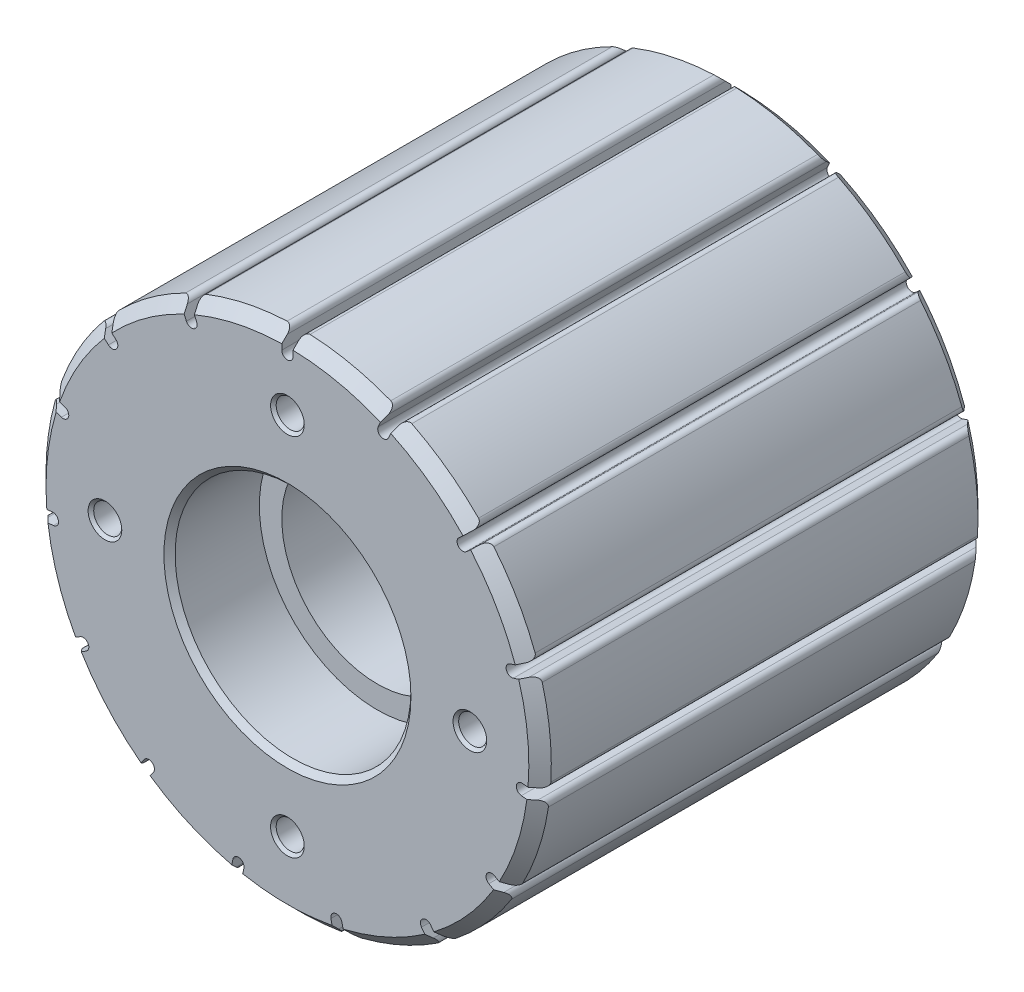
from build123d import *

# Parameters (mm, degrees)
SKETCH2_R                    = 45
SKETCH2_R_2                  = 21
BOSS_EXTRUDE1_DEPTH          = 40
CHAMFER3_SIZE                = 2
CUT_EXTRUDE1_DEPTH           = 76.166481892
FILLET1_R                    = 1
CIRPATTERN1_COUNT            = 15
FILLET1_OF_CIRPATTERN1_R     = 1
SKETCH4_R                    = 21
SKETCH4_R_2                  = 17
BOSS_EXTRUDE2_DEPTH          = 24
SKETCH6_W                    = 1.85
SKETCH6_H                    = 23.75
CHAMFER2_SIZE                = 1
SKETCH8_R                    = 2.5
CUT_EXTRUDE2_DEPTH           = 25
CHAMFER1_SIZE                = 0.5
CIRPATTERN2_COUNT            = 4
CHAMFER1_OF_CIRPATTERN2_SIZE = 0.5


with BuildPart() as part:
    # Sketch2 → Boss-Extrude1 (new, symmetric)
    with BuildSketch(Plane.XY):
        Circle(SKETCH2_R)
        Circle(SKETCH2_R_2, mode=Mode.SUBTRACT)
    extrude(amount=BOSS_EXTRUDE1_DEPTH, both=True)

    # Chamfer3
    chamfer3_edges = [part.edges().sort_by_distance(p)[0] for p in [
        (-45, 0, -40),
        (-45, 0, 40),
    ]]
    chamfer(chamfer3_edges, length=CHAMFER3_SIZE)

    # Sketch3 → Cut-Extrude1 (cut, symmetric)
    with BuildSketch(Plane.XY):
        with BuildLine():
            Line((1, 45), (1, 42))
            ThreePointArc((1, 42), (0, 41), (-1, 42))
            Line((-1, 42), (-1, 45))
            ThreePointArc((-1, 45), (0, 46), (1, 45))
        make_face()
    cut_extrude1 = extrude(amount=CUT_EXTRUDE1_DEPTH, both=True, mode=Mode.SUBTRACT)

    # Fillet1
    fillet1_edges = [part.edges().sort_by_distance(p)[0] for p in [
        (-1, 44.988887517, 0),
        (1, 44.988887517, 0),
    ]]
    fillet(fillet1_edges, radius=FILLET1_R)

    # CirPattern1: Cut-Extrude1 ×15 about axis
    cirpattern1_axis = Axis((0, 0, 0), (0, 0, 1))
    for i in range(1, CIRPATTERN1_COUNT):
        add(cut_extrude1.rotate(cirpattern1_axis, i * 360 / CIRPATTERN1_COUNT), mode=Mode.SUBTRACT)

    # Fillet1 of CirPattern1
    fillet1_of_cirpattern1_edges = [part.edges().sort_by_distance(p)[0] for p in [
        (-19.212174542, 40.692657192, 0),
        (-17.385083627, 41.506130478, 0),
        (-34.102389568, 29.360296758, 0),
        (-32.764128356, 30.846586409, 0),
        (-43.095991628, 12.951274284, 0),
        (-42.477957639, 14.853387317, 0),
        (-44.63790522, -5.697141172, 0),
        (-44.846962147, -3.708097381, 0),
        (-38.461519478, -23.360469162, 0),
        (-39.461519478, -21.628418355, 0),
        (-25.634787605, -36.984559811, 0),
        (-27.252821594, -35.808989307, 0),
        (-8.375568071, -44.213684075, 0),
        (-10.331863272, -43.797860693, 0),
        (10.331863272, -43.797860693, 0),
        (8.375568071, -44.213684075, 0),
        (27.252821594, -35.808989307, 0),
        (25.634787605, -36.984559811, 0),
        (39.461519478, -21.628418355, 0),
        (38.461519478, -23.360469162, 0),
        (44.846962147, -3.708097381, 0),
        (44.63790522, -5.697141172, 0),
        (42.477957639, 14.853387317, 0),
        (43.095991628, 12.951274284, 0),
        (32.764128356, 30.846586409, 0),
        (34.102389568, 29.360296758, 0),
        (17.385083627, 41.506130478, 0),
        (19.212174542, 40.692657192, 0),
    ]]
    fillet(fillet1_of_cirpattern1_edges, radius=FILLET1_OF_CIRPATTERN1_R)

    # Sketch4 → Boss-Extrude2 (add, symmetric)
    with BuildSketch(Plane.XY):
        Circle(SKETCH4_R)
        Circle(SKETCH4_R_2, mode=Mode.SUBTRACT)
    extrude(amount=BOSS_EXTRUDE2_DEPTH, both=True)

    # Sketch6 → Cut-Revolve1 (revolve, cut)
    with BuildSketch(Plane(origin=(0, 0, 0), x_dir=(0, 0, -1), z_dir=(1, 0, 0)), mode=Mode.PRIVATE) as cut_revolve1_sk:
        with Locations((36.825, -11.875)):
            Rectangle(SKETCH6_W, SKETCH6_H)
    revolve(cut_revolve1_sk.sketch.rotate(Axis((0, 0, 0), (0, 0, -1)), 270), axis=Axis((0, 0, 0), (0, 0, -1)), mode=Mode.SUBTRACT)

    # Chamfer2
    chamfer2_edges = [part.edges().sort_by_distance(p)[0] for p in [
        (-21, 0, -40),
        (-21, 0, 40),
    ]]
    chamfer(chamfer2_edges, length=CHAMFER2_SIZE)

    # Sketch8 → Cut-Extrude2 (cut)
    with BuildSketch(Plane.XY.offset(40)):
        with Locations((0, 32.5)):
            Circle(SKETCH8_R)
    cut_extrude2 = extrude(amount=-CUT_EXTRUDE2_DEPTH, mode=Mode.SUBTRACT)

    # Cut-Extrude3 cone 1 section (through the dimple's axis) → Cut-Extrude3 (revolve, cut)
    with BuildSketch(Plane(origin=(0, 32.5, 15), x_dir=(0, -1, 0), z_dir=(1, 0, 0))):
        Polygon((0, 0), (2.5, 0), (0, 1.165769145), align=None)
    cut_extrude3 = revolve(axis=Axis((0, 32.5, 15), (0, 0, -1)), mode=Mode.SUBTRACT)

    # Chamfer1
    chamfer1_edges = [part.edges().sort_by_distance(p)[0] for p in [
        (-2.5, 32.5, 40),
    ]]
    chamfer(chamfer1_edges, length=CHAMFER1_SIZE)

    # CirPattern2: Cut-Extrude2, Cut-Extrude3 ×4 about axis
    cirpattern2_axis = Axis((0, 0, 0), (0, 0, 1))
    add([cut_extrude2.rotate(cirpattern2_axis, i * 360 / CIRPATTERN2_COUNT) for i in range(1, CIRPATTERN2_COUNT)], mode=Mode.SUBTRACT)
    add([cut_extrude3.rotate(cirpattern2_axis, i * 360 / CIRPATTERN2_COUNT) for i in range(1, CIRPATTERN2_COUNT)], mode=Mode.SUBTRACT)

    # Chamfer1 of CirPattern2
    chamfer1_of_cirpattern2_edges = [part.edges().sort_by_distance(p)[0] for p in [
        (-32.5, -2.5, 40),
        (2.5, -32.5, 40),
        (32.5, 2.5, 40),
    ]]
    chamfer(chamfer1_of_cirpattern2_edges, length=CHAMFER1_OF_CIRPATTERN2_SIZE)


solid = part.part
